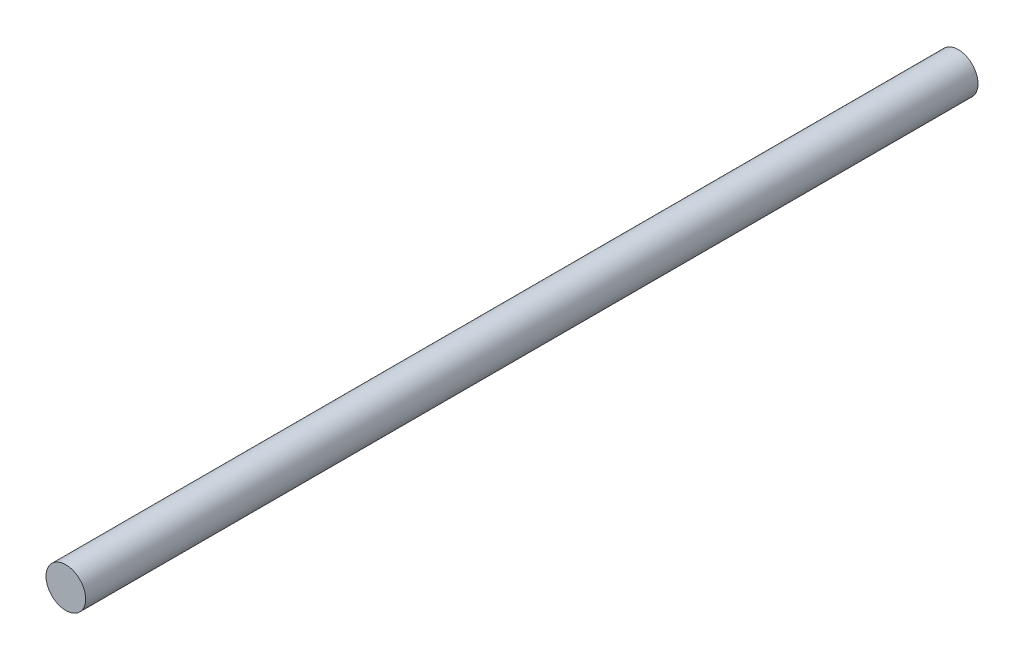
from build123d import *

# Parameters (mm, degrees)
SKETCH1_R           = 4
BOSS_EXTRUDE1_DEPTH = 180


with BuildPart() as part:
    # Sketch1 → Boss-Extrude1 (new body)
    with BuildSketch(Plane.XY):
        with Locations(Location((0, 0, 0), (0, 0, 180))):
            Circle(SKETCH1_R)
    extrude(amount=BOSS_EXTRUDE1_DEPTH)


solid = part.part
